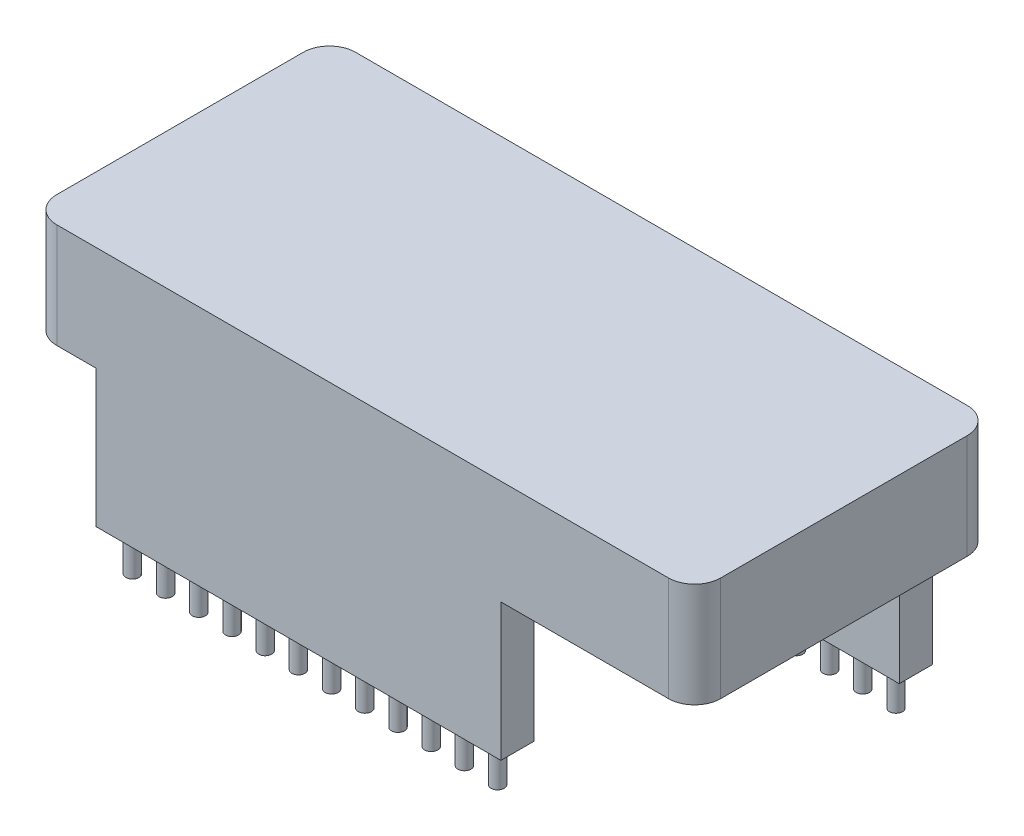
from build123d import *

# Parameters (mm, degrees)
BOSS_EXTRUDE1_DEPTH = 8
SKETCH2_W           = 30.98
SKETCH2_H           = 2.54
SKETCH2_W_2         = 41.14
BOSS_EXTRUDE2_DEPTH = 10.5
SKETCH3_R           = 0.5
BOSS_EXTRUDE3_DEPTH = 3


with BuildPart() as part:
    # Sketch1 → Boss-Extrude1 (new body)
    with BuildSketch(Plane(origin=(0, 0, 0), x_dir=(1, 0, 0), z_dir=(0, 1, 0))):
        with BuildLine():
            Line((2, 0), (48.8, 0))
            ThreePointArc((48.8, 0), (50.214213562, 0.585786438), (50.8, 2))
            Line((50.8, 2), (50.8, 20.86))
            ThreePointArc((50.8, 20.86), (50.214213562, 22.274213562), (48.8, 22.86))
            Line((48.8, 22.86), (2, 22.86))
            ThreePointArc((2, 22.86), (0.585786438, 22.274213562), (0, 20.86))
            Line((0, 20.86), (0, 2))
            ThreePointArc((0, 2), (0.585786438, 0.585786438), (2, 0))
        make_face()
    extrude(amount=BOSS_EXTRUDE1_DEPTH)

    # Sketch2 → Boss-Extrude2 (add)
    with BuildSketch(Plane.XZ):
        with Locations((20.49, -1.27)):
            Rectangle(SKETCH2_W, SKETCH2_H)
        with Locations((25.57, -21.59)):
            Rectangle(SKETCH2_W_2, SKETCH2_H)
    extrude(amount=BOSS_EXTRUDE2_DEPTH)

    # Sketch3 → Boss-Extrude3 (add)
    with BuildSketch(Plane.XZ.offset(10.5)):
        with Locations(Location((6.52, -1.27, 0), (0, 0, 270))):
            Circle(SKETCH3_R)
        with Locations(Location((9.06, -1.27, 0), (0, 0, 270))):
            Circle(SKETCH3_R)
        with Locations(Location((11.6, -1.27, 0), (0, 0, 270))):
            Circle(SKETCH3_R)
        with Locations(Location((14.14, -1.27, 0), (0, 0, 270))):
            Circle(SKETCH3_R)
        with Locations(Location((16.68, -1.27, 0), (0, 0, 270))):
            Circle(SKETCH3_R)
        with Locations(Location((19.22, -1.27, 0), (0, 0, 270))):
            Circle(SKETCH3_R)
        with Locations(Location((21.76, -1.27, 0), (0, 0, 270))):
            Circle(SKETCH3_R)
        with Locations(Location((24.3, -1.27, 0), (0, 0, 270))):
            Circle(SKETCH3_R)
        with Locations(Location((26.84, -1.27, 0), (0, 0, 270))):
            Circle(SKETCH3_R)
        with Locations(Location((29.38, -1.27, 0), (0, 0, 270))):
            Circle(SKETCH3_R)
        with Locations(Location((31.92, -1.27, 0), (0, 0, 270))):
            Circle(SKETCH3_R)
        with Locations(Location((34.46, -1.27, 0), (0, 0, 270))):
            Circle(SKETCH3_R)
        with Locations(Location((6.52, -21.59, 0), (0, 0, 90))):
            Circle(SKETCH3_R)
        with Locations(Location((9.06, -21.59, 0), (0, 0, 90))):
            Circle(SKETCH3_R)
        with Locations(Location((11.6, -21.59, 0), (0, 0, 90))):
            Circle(SKETCH3_R)
        with Locations(Location((14.14, -21.59, 0), (0, 0, 90))):
            Circle(SKETCH3_R)
        with Locations(Location((16.68, -21.59, 0), (0, 0, 90))):
            Circle(SKETCH3_R)
        with Locations(Location((19.22, -21.59, 0), (0, 0, 90))):
            Circle(SKETCH3_R)
        with Locations(Location((21.76, -21.59, 0), (0, 0, 90))):
            Circle(SKETCH3_R)
        with Locations(Location((24.3, -21.59, 0), (0, 0, 90))):
            Circle(SKETCH3_R)
        with Locations(Location((26.84, -21.59, 0), (0, 0, 90))):
            Circle(SKETCH3_R)
        with Locations(Location((29.38, -21.59, 0), (0, 0, 90))):
            Circle(SKETCH3_R)
        with Locations(Location((31.92, -21.59, 0), (0, 0, 90))):
            Circle(SKETCH3_R)
        with Locations(Location((34.46, -21.59, 0), (0, 0, 90))):
            Circle(SKETCH3_R)
        with Locations(Location((37, -21.59, 0), (0, 0, 90))):
            Circle(SKETCH3_R)
        with Locations(Location((39.54, -21.59, 0), (0, 0, 90))):
            Circle(SKETCH3_R)
        with Locations(Location((42.08, -21.59, 0), (0, 0, 90))):
            Circle(SKETCH3_R)
        with Locations(Location((44.62, -21.59, 0), (0, 0, 90))):
            Circle(SKETCH3_R)
    extrude(amount=BOSS_EXTRUDE3_DEPTH)


solid = part.part
